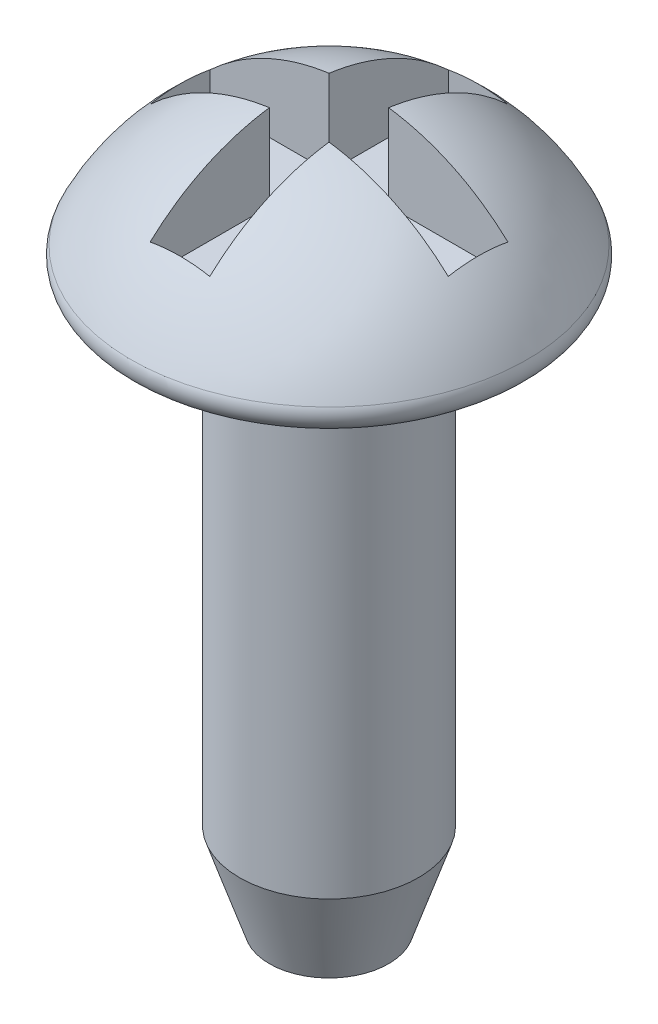
from build123d import *

# Parameters (mm, degrees)
FILLET1_R          = 0.3
CUT_EXTRUDE1_START = 1
CUT_EXTRUDE1_DEPTH = 10.616564891


with BuildPart() as part:
    # Sketch1 → Revolve1 (revolve)
    with BuildSketch(Plane.XY, mode=Mode.PRIVATE) as revolve1_sk:
        with BuildLine():
            Line((-1.5, 0), (-1.5, -8))
            Line((-1.5, -8), (-1, -9.5))
            Line((-1, -9.5), (0, -9.5))
            Line((0, -9.5), (0, 2.5))
            ThreePointArc((0, 2.5), (-2.150581317, 1.810813843), (-3.5, 0))
            Line((-3.5, 0), (-1.5, 0))
        make_face()
    revolve(revolve1_sk.sketch.rotate(Axis((0, -2.514017632, 0), (0, -1, 0)), 270), axis=Axis((0, -2.514017632, 0), (0, -1, 0)))

    # Fillet1
    fillet1_edges = [part.edges().sort_by_distance(p)[0] for p in [
        (0, 0, -3.5),
    ]]
    fillet(fillet1_edges, radius=FILLET1_R)

    # Sketch2 → Cut-Extrude1 (cut, through all)
    with BuildSketch(Plane(origin=(0, 0, 0), x_dir=(1, 0, 0), z_dir=(0, 1, 0)).offset(CUT_EXTRUDE1_START)):
        Polygon((0.5, 0.5), (2.5, 0.5), (2.5, -0.5), (0.5, -0.5), (0.5, -2.5), (-0.5, -2.5), (-0.5, -0.5), (-2.5, -0.5), (-2.5, 0.5), (-0.5, 0.5), (-0.5, 2.5), (0.5, 2.5), align=None)
    extrude(amount=CUT_EXTRUDE1_DEPTH, mode=Mode.SUBTRACT)


solid = part.part
